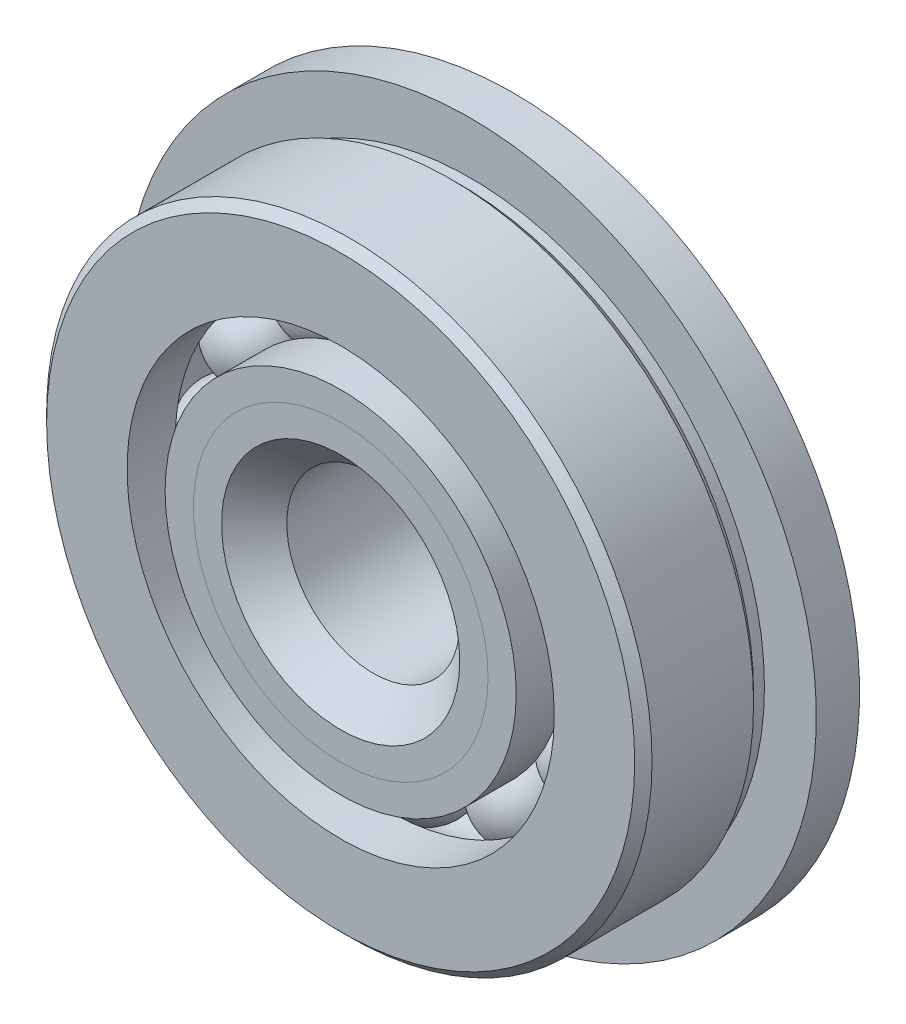
from build123d import *

# Parameters (mm, degrees)
SKETCH5_W         = 1.5875
SKETCH5_H         = 3.381723901
CIRPATTERN1_COUNT = 12


with BuildPart() as part:
    # Sketch1 → Revolve1 (revolve)
    with BuildSketch(Plane(origin=(0, 0, 0), x_dir=(0, 0, -1), z_dir=(1, 0, 0))):
        with BuildLine():
            Line((2.8575, 11.1125), (-2.8575, 11.1125))
            Line((-2.8575, 11.1125), (-3.175, 10.795))
            Line((-3.175, 10.795), (-3.175, 7.841552198))
            Line((-3.175, 7.841552198), (-1.411111111, 7.841552198))
            ThreePointArc((-1.411111111, 7.841552198), (0, 8.717968052), (1.411111111, 7.841552198))
            Line((1.411111111, 7.841552198), (3.175, 7.841552198))
            Line((3.175, 7.841552198), (3.175, 10.795))
            Line((3.175, 10.795), (2.8575, 11.1125))
        make_face()
    revolve(axis=Axis((0, 0, 3.175), (0, 0, -1)))

    # Sketch5 → Revolve5 (revolve)
    with BuildSketch(Plane(origin=(0, 0, 0), x_dir=(0, 0, -1), z_dir=(1, 0, 0))):
        with Locations((2.38125, 11.00913805)):
            Rectangle(SKETCH5_W, SKETCH5_H)
    revolve(axis=Axis((0, 0, -4.7625), (0, 0, 1)))

    # Sketch6 → Cut-Revolve1 (revolve, cut)
    with BuildSketch(Plane(origin=(0, 0, 0), x_dir=(0, 0, -1), z_dir=(1, 0, 0))):
        Polygon((0.873125, 11.1125), (1.190625, 10.795), (1.5875, 10.795), (1.5875, 11.1125), align=None)
    revolve(axis=Axis((0, 0, 3.175), (0, 0, -1)), mode=Mode.SUBTRACT)


with BuildPart() as body_2:
    # Sketch2 → Revolve2 (revolve)
    with BuildSketch(Plane(origin=(0, 0, 0), x_dir=(0, 0, -1), z_dir=(1, 0, 0))):
        with BuildLine():
            Line((-3.175, 6.445947802), (-1.411111111, 6.445947802))
            ThreePointArc((-1.411111111, 6.445947802), (-0.830562959, 5.806466318), (0, 5.569531948))
            Line((0, 5.569531948), (0, 4.372265974))
            Line((0, 4.372265974), (-2.138159086, 4.372265974))
            Line((-2.138159086, 4.372265974), (-3.175, 5.409106888))
            Line((-3.175, 5.409106888), (-3.175, 6.445947802))
        make_face()
    revolve(axis=Axis((0, 0, 3.175), (0, 0, -1)))


with BuildPart() as body_3:
    # Sketch3 → Revolve3 (revolve)
    with BuildSketch(Plane(origin=(0, 0, 0), x_dir=(0, 0, -1), z_dir=(1, 0, 0))):
        with BuildLine():
            Line((-3.175, 5.409106888), (-2.138159086, 4.372265974))
            Line((-2.138159086, 4.372265974), (0, 4.372265974))
            Line((0, 4.372265974), (0, 5.569531948))
            ThreePointArc((0, 5.569531948), (0.830562959, 5.806466318), (1.411111111, 6.445947802))
            Line((1.411111111, 6.445947802), (4.7625, 6.445947802))
            Line((4.7625, 6.445947802), (4.7625, 3.4925))
            Line((4.7625, 3.4925), (4.445, 3.175))
            Line((4.445, 3.175), (-1.977734026, 3.175))
            Line((-1.977734026, 3.175), (-3.175, 4.372265974))
            Line((-3.175, 4.372265974), (-3.175, 5.409106888))
        make_face()
    revolve(axis=Axis((0, 0, 3.175), (0, 0, -1)))


with BuildPart() as body_4:
    # Sketch4 → Revolve4 (revolve)
    with BuildSketch(Plane(origin=(0, 0, 0), x_dir=(0, 0, -1), z_dir=(1, 0, 0))):
        with BuildLine():
            Line((-1.574218052, 7.14375), (1.574218052, 7.14375))
            ThreePointArc((1.574218052, 7.14375), (0, 8.717968052), (-1.574218052, 7.14375))
        make_face()
    revolve(axis=Axis((0, 7.14375, 1.574218052), (0, 0, -1)))


with BuildPart() as cirpattern1_1:
    # CirPattern1: pattern copy
    add(body_4.part.rotate(Axis((0, 0, -3.175), (0, 0, 1)), 1 * 360 / CIRPATTERN1_COUNT))


with BuildPart() as cirpattern1_2:
    # CirPattern1: pattern copy
    add(body_4.part.rotate(Axis((0, 0, -3.175), (0, 0, 1)), 2 * 360 / CIRPATTERN1_COUNT))


with BuildPart() as cirpattern1_3:
    # CirPattern1: pattern copy
    add(body_4.part.rotate(Axis((0, 0, -3.175), (0, 0, 1)), 3 * 360 / CIRPATTERN1_COUNT))


with BuildPart() as cirpattern1_4:
    # CirPattern1: pattern copy
    add(body_4.part.rotate(Axis((0, 0, -3.175), (0, 0, 1)), 4 * 360 / CIRPATTERN1_COUNT))


with BuildPart() as cirpattern1_5:
    # CirPattern1: pattern copy
    add(body_4.part.rotate(Axis((0, 0, -3.175), (0, 0, 1)), 5 * 360 / CIRPATTERN1_COUNT))


with BuildPart() as cirpattern1_6:
    # CirPattern1: pattern copy
    add(body_4.part.rotate(Axis((0, 0, -3.175), (0, 0, 1)), 6 * 360 / CIRPATTERN1_COUNT))


with BuildPart() as cirpattern1_7:
    # CirPattern1: pattern copy
    add(body_4.part.rotate(Axis((0, 0, -3.175), (0, 0, 1)), 7 * 360 / CIRPATTERN1_COUNT))


with BuildPart() as cirpattern1_8:
    # CirPattern1: pattern copy
    add(body_4.part.rotate(Axis((0, 0, -3.175), (0, 0, 1)), 8 * 360 / CIRPATTERN1_COUNT))


with BuildPart() as cirpattern1_9:
    # CirPattern1: pattern copy
    add(body_4.part.rotate(Axis((0, 0, -3.175), (0, 0, 1)), 9 * 360 / CIRPATTERN1_COUNT))


with BuildPart() as cirpattern1_10:
    # CirPattern1: pattern copy
    add(body_4.part.rotate(Axis((0, 0, -3.175), (0, 0, 1)), 10 * 360 / CIRPATTERN1_COUNT))


with BuildPart() as cirpattern1_11:
    # CirPattern1: pattern copy
    add(body_4.part.rotate(Axis((0, 0, -3.175), (0, 0, 1)), 11 * 360 / CIRPATTERN1_COUNT))


solid = Compound([part.part, body_2.part, body_3.part, body_4.part, cirpattern1_1.part, cirpattern1_2.part, cirpattern1_3.part, cirpattern1_4.part, cirpattern1_5.part, cirpattern1_6.part, cirpattern1_7.part, cirpattern1_8.part, cirpattern1_9.part, cirpattern1_10.part, cirpattern1_11.part])
